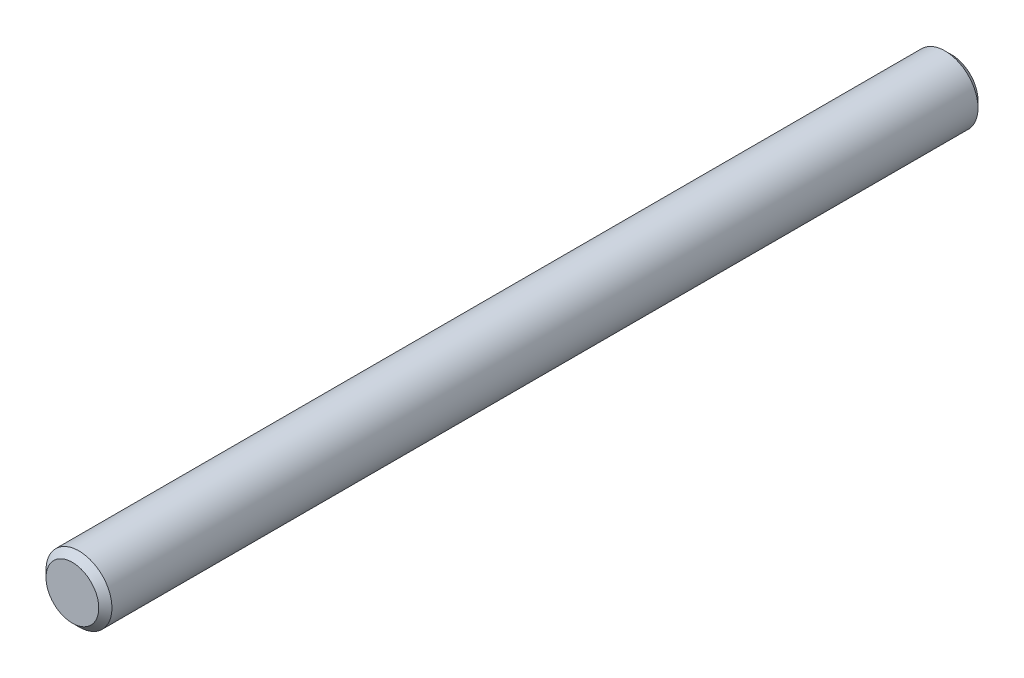
from build123d import *

# Parameters (mm, degrees)
SKETCH_1_R      = 1.5
EXTRUDE_1_DEPTH = 20
CHAMFER_1_SIZE  = 0.3


with BuildPart() as part:
    # Эскиз1 → Бобышка-Вытянуть1 (new, symmetric)
    with BuildSketch(Plane.XY):
        Circle(SKETCH_1_R)
    extrude(amount=EXTRUDE_1_DEPTH, both=True)

    # Фаска1
    chamfer_1_edges = [part.edges().sort_by_distance(p)[0] for p in [
        (-1.5, 0, -20),
        (-1.5, 0, 20),
    ]]
    chamfer(chamfer_1_edges, length=CHAMFER_1_SIZE)


solid = part.part
